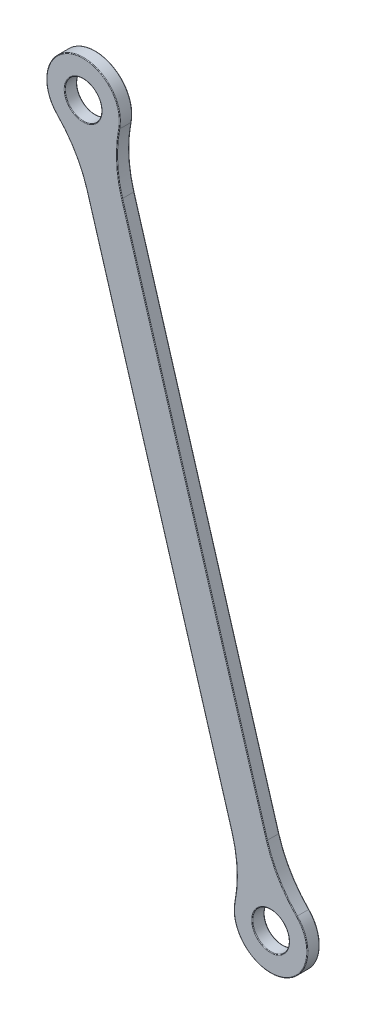
from build123d import *

# Parameters (mm, degrees)
BOSS_EXTRUDE1_DEPTH = 3
FILLET1_R           = 30
FILLET2_R           = 0.15


with BuildPart() as part:
    # Sketch1 → Boss-Extrude1 (new body)
    with BuildSketch(Plane.XY):
        with BuildLine():
            ThreePointArc((-16.456883788, 209.255678976), (-13.437893868, 214.857973136), (-7.835599707, 211.838983217))
            Line((-7.835599707, 211.838983217), (-5.598392608, 204.37273219))
            ThreePointArc((-5.598392608, 204.37273219), (-3.781714198, 207.225482383), (-3.146241747, 210.547331096))
            ThreePointArc((-3.146241747, 210.547331096), (-17.729210739, 217.606400244), (-14.219676689, 201.789427949))
            Line((-14.219676689, 201.789427949), (-16.456883788, 209.255678976))
        make_face()
        with BuildLine():
            Line((35.852601927, 66.037961701), (-5.598392608, 204.37273219))
            ThreePointArc((-5.598392608, 204.37273219), (-9.562937506, 201.926047016), (-14.219676689, 201.789427949))
            Line((-14.219676689, 201.789427949), (27.231317847, 63.45465746))
            ThreePointArc((27.231317847, 63.45465746), (31.195862744, 65.901342634), (35.852601927, 66.037961701))
        make_face()
        with BuildLine():
            ThreePointArc((42.779166986, 57.280058553), (40.838236134, 62.863027545), (35.852601927, 66.037961701))
            Line((35.852601927, 66.037961701), (38.089809026, 58.571710674))
            ThreePointArc((38.089809026, 58.571710674), (35.070819106, 52.969416513), (29.468524945, 55.988406433))
            Line((29.468524945, 55.988406433), (27.231317847, 63.45465746))
            ThreePointArc((27.231317847, 63.45465746), (30.457318272, 48.915531004), (42.779166986, 57.280058553))
        make_face()
        with BuildLine():
            Line((38.089809026, 58.571710674), (35.852601927, 66.037961701))
            ThreePointArc((35.852601927, 66.037961701), (31.195862744, 65.901342634), (27.231317847, 63.45465746))
            Line((27.231317847, 63.45465746), (29.468524945, 55.988406433))
            ThreePointArc((29.468524945, 55.988406433), (32.487514865, 61.590700594), (38.089809026, 58.571710674))
        make_face()
        with BuildLine():
            Line((-5.598392608, 204.37273219), (-7.835599707, 211.838983217))
            ThreePointArc((-7.835599707, 211.838983217), (-10.854589627, 206.236689056), (-16.456883788, 209.255678976))
            Line((-16.456883788, 209.255678976), (-14.219676689, 201.789427949))
            ThreePointArc((-14.219676689, 201.789427949), (-9.562937506, 201.926047016), (-5.598392608, 204.37273219))
        make_face()
    extrude(amount=-BOSS_EXTRUDE1_DEPTH)

    # Fillet1
    fillet1_edges = [part.edges().sort_by_distance(p)[0] for p in [
        (-5.598392608, 204.37273219, -1.5),
        (35.852601927, 66.037961701, -1.5),
        (27.231317847, 63.45465746, -1.5),
        (-14.219676689, 201.789427949, -1.5),
    ]]
    fillet(fillet1_edges, radius=FILLET1_R)

    # Fillet2
    fillet2_edges = [part.edges().sort_by_distance(p)[0] for p in [
        (29.468524945, 55.988406433, 0),
        (6.505820579, 132.622042704, 0),
        (6.505820579, 132.622042704, -3),
        (32.907540512, 48.322365363, 0),
        (32.907540512, 48.322365363, -3),
        (-14.729545989, 219.168615177, 0),
        (-14.729545989, 219.168615177, -3),
        (15.127104659, 135.205346945, 0),
        (15.127104659, 135.205346945, -3),
        (-7.835599707, 211.838983217, -3),
        (25.475389973, 66.255022831, 0),
        (25.475389973, 66.255022831, -3),
        (-14.146316355, 198.484893614, 0),
        (-14.146316355, 198.484893614, -3),
        (-3.842464735, 201.572366819, 0),
        (-3.842464735, 201.572366819, -3),
        (35.779241593, 69.342496036, 0),
        (35.779241593, 69.342496036, -3),
        (29.468524945, 55.988406433, -3),
        (-7.835599707, 211.838983217, 0),
    ]]
    fillet(fillet2_edges, radius=FILLET2_R)


solid = part.part
